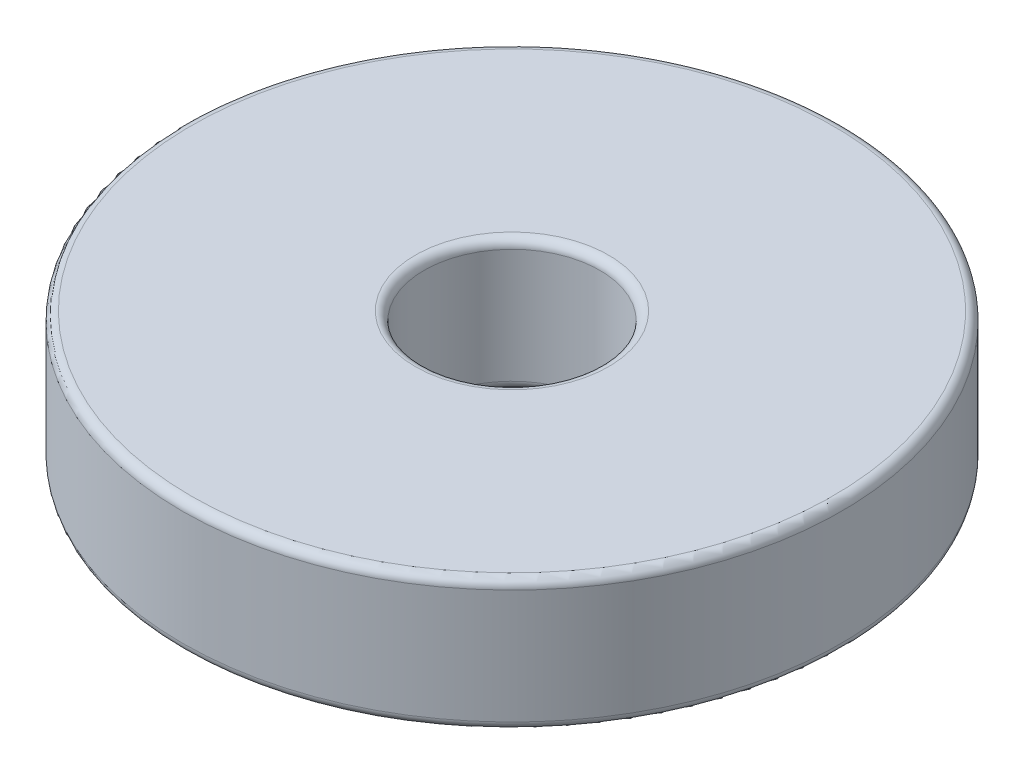
from build123d import *

# Parameters (mm, degrees)
SKETCH1_R           = 7.5
SKETCH1_R_2         = 2
BOSS_EXTRUDE1_DEPTH = 3
FILLET1_R           = 0.2


with BuildPart() as part:
    # Sketch1 → Boss-Extrude1 (new body)
    with BuildSketch(Plane(origin=(0, 0, 0), x_dir=(1, 0, 0), z_dir=(0, 1, 0))):
        with Locations(Location((0, 0, 0), (0, 0, 270))):
            Circle(SKETCH1_R)
        with Locations(Location((0, 0, 0), (0, 0, 270))):
            Circle(SKETCH1_R_2, mode=Mode.SUBTRACT)
    extrude(amount=BOSS_EXTRUDE1_DEPTH)

    # Fillet1
    fillet1_edges = [part.edges().sort_by_distance(p)[0] for p in [
        (0, 0, -7.5),
        (0, 3, -7.5),
        (0, 0, -2),
        (0, 3, -2),
    ]]
    fillet(fillet1_edges, radius=FILLET1_R)


solid = part.part
